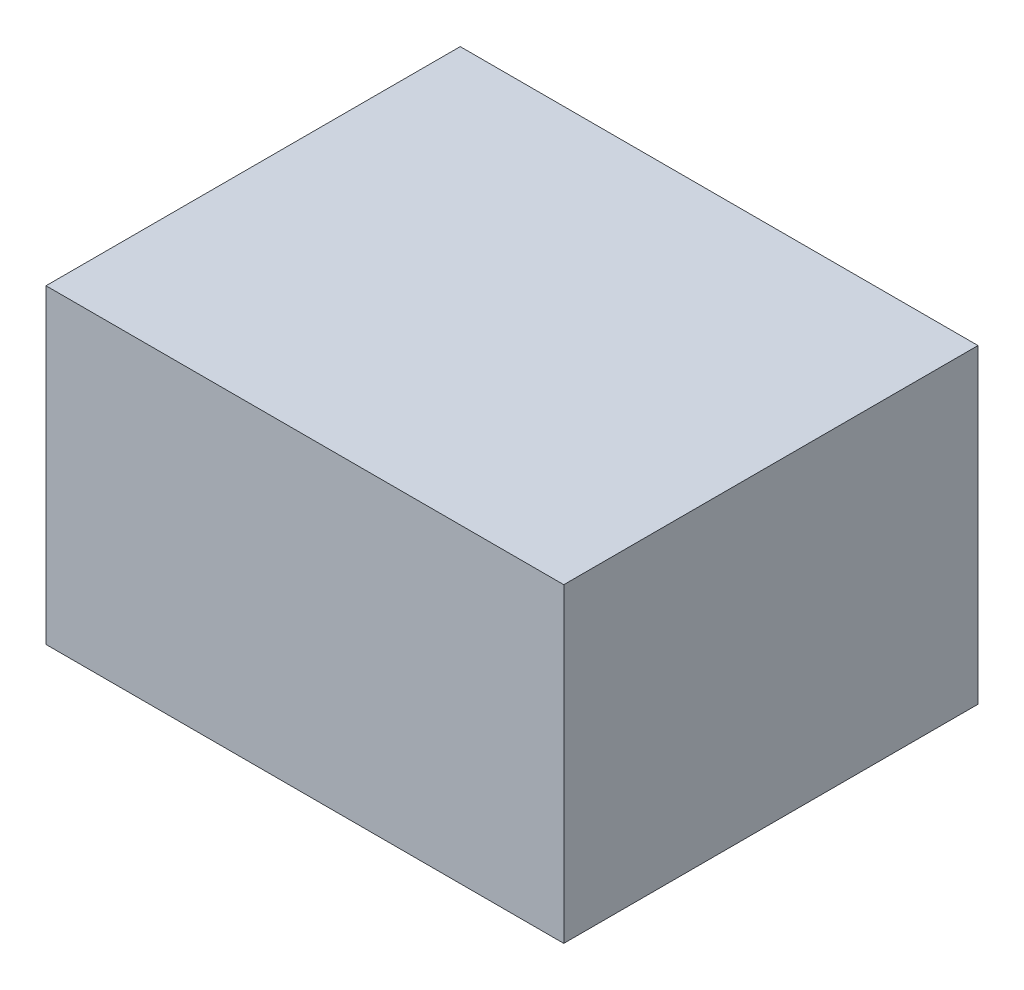
from build123d import *

# Parameters (mm, degrees)
SKETCH1_W           = 50
SKETCH1_H           = 30
BOSS_EXTRUDE1_DEPTH = 40


with BuildPart() as part:
    # Sketch1 → Boss-Extrude1 (new body)
    with BuildSketch(Plane.XY):
        with Locations((25, 15)):
            Rectangle(SKETCH1_W, SKETCH1_H)
    extrude(amount=BOSS_EXTRUDE1_DEPTH)


solid = part.part
